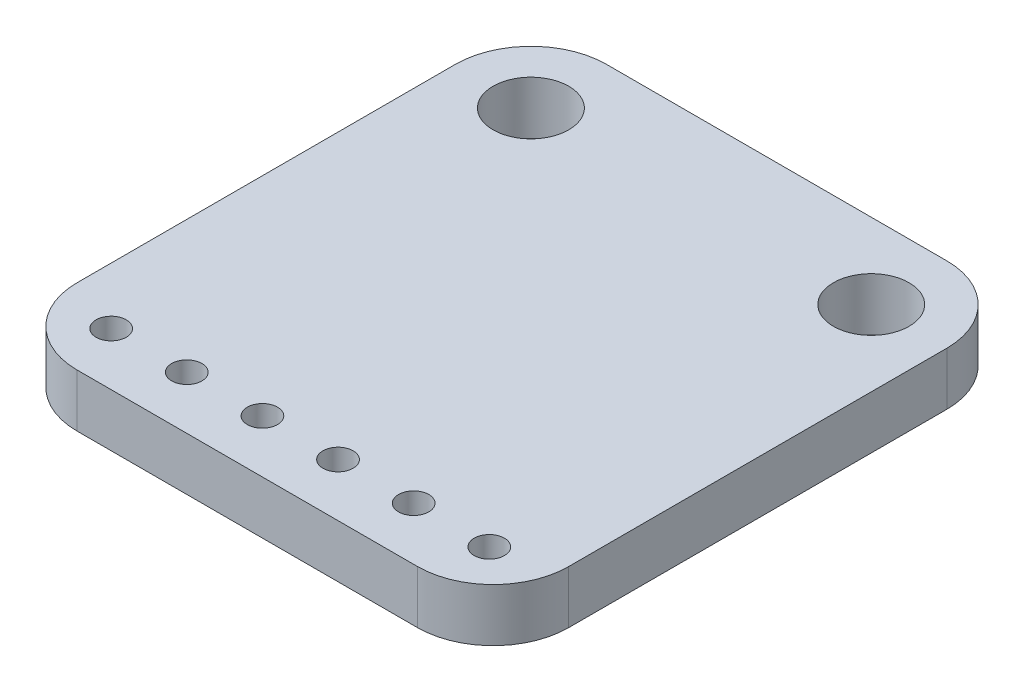
from build123d import *

# Parameters (mm, degrees)
SKETCH1_W           = 16.51
SKETCH1_H           = 17.78
BOSS_EXTRUDE1_DEPTH = 1.778
FILLET1_R           = 2.54
CUT_EXTRUDE1_REACH  = 14.261
SKETCH2_R           = 0.508
SKETCH4_W           = 3.95
SKETCH4_H           = 3.95
BOSS_EXTRUDE3_DEPTH = 1.397
CUT_EXTRUDE2_REACH  = 14.261
SKETCH5_R           = 1.27


with BuildPart() as part:
    # Sketch1 → Boss-Extrude1 (new body)
    with BuildSketch(Plane(origin=(0, 0, 0), x_dir=(1, 0, 0), z_dir=(0, 1, 0))):
        Rectangle(SKETCH1_W, SKETCH1_H)
    extrude(amount=BOSS_EXTRUDE1_DEPTH)

    # Fillet1
    fillet1_edges = [part.edges().sort_by_distance(p)[0] for p in [
        (8.255, 0.889, 8.89),
        (-8.255, 0.889, 8.89),
        (-8.255, 0.889, -8.89),
        (8.255, 0.889, -8.89),
    ]]
    fillet(fillet1_edges, radius=FILLET1_R)

    # Sketch2 → Cut-Extrude1 (cut, up to next)
    with BuildSketch(Plane(origin=(0, 1.778, 0), x_dir=(1, 0, 0), z_dir=(0, 1, 0)), mode=Mode.PRIVATE) as cut_extrude1_sk1:
        with Locations(Location((-6.35, -7.112, 0), (0, 0, 270))):
            Circle(SKETCH2_R)
    cut_extrude1_tool1 = extrude(cut_extrude1_sk1.sketch, amount=-CUT_EXTRUDE1_REACH, mode=Mode.PRIVATE) & part.part
    # Sketch2 → Cut-Extrude1 (cut, up to next)
    with BuildSketch(Plane(origin=(0, 1.778, 0), x_dir=(1, 0, 0), z_dir=(0, 1, 0)), mode=Mode.PRIVATE) as cut_extrude1_sk2:
        with Locations(Location((-3.81, -7.112, 0), (0, 0, 270))):
            Circle(SKETCH2_R)
    cut_extrude1_tool2 = extrude(cut_extrude1_sk2.sketch, amount=-CUT_EXTRUDE1_REACH, mode=Mode.PRIVATE) & part.part
    # Sketch2 → Cut-Extrude1 (cut, up to next)
    with BuildSketch(Plane(origin=(0, 1.778, 0), x_dir=(1, 0, 0), z_dir=(0, 1, 0)), mode=Mode.PRIVATE) as cut_extrude1_sk3:
        with Locations(Location((-1.27, -7.112, 0), (0, 0, 270))):
            Circle(SKETCH2_R)
    cut_extrude1_tool3 = extrude(cut_extrude1_sk3.sketch, amount=-CUT_EXTRUDE1_REACH, mode=Mode.PRIVATE) & part.part
    # Sketch2 → Cut-Extrude1 (cut, up to next)
    with BuildSketch(Plane(origin=(0, 1.778, 0), x_dir=(1, 0, 0), z_dir=(0, 1, 0)), mode=Mode.PRIVATE) as cut_extrude1_sk4:
        with Locations(Location((1.27, -7.112, 0), (0, 0, 270))):
            Circle(SKETCH2_R)
    cut_extrude1_tool4 = extrude(cut_extrude1_sk4.sketch, amount=-CUT_EXTRUDE1_REACH, mode=Mode.PRIVATE) & part.part
    # Sketch2 → Cut-Extrude1 (cut, up to next)
    with BuildSketch(Plane(origin=(0, 1.778, 0), x_dir=(1, 0, 0), z_dir=(0, 1, 0)), mode=Mode.PRIVATE) as cut_extrude1_sk5:
        with Locations(Location((3.81, -7.112, 0), (0, 0, 270))):
            Circle(SKETCH2_R)
    cut_extrude1_tool5 = extrude(cut_extrude1_sk5.sketch, amount=-CUT_EXTRUDE1_REACH, mode=Mode.PRIVATE) & part.part
    # Sketch2 → Cut-Extrude1 (cut, up to next)
    with BuildSketch(Plane(origin=(0, 1.778, 0), x_dir=(1, 0, 0), z_dir=(0, 1, 0)), mode=Mode.PRIVATE) as cut_extrude1_sk6:
        with Locations(Location((6.35, -7.112, 0), (0, 0, 270))):
            Circle(SKETCH2_R)
    cut_extrude1_tool6 = extrude(cut_extrude1_sk6.sketch, amount=-CUT_EXTRUDE1_REACH, mode=Mode.PRIVATE) & part.part
    add(cut_extrude1_tool1.solids().sort_by_distance((-6.35, 1.778, 7.112))[0], mode=Mode.SUBTRACT)
    add(cut_extrude1_tool2.solids().sort_by_distance((-3.81, 1.778, 7.112))[0], mode=Mode.SUBTRACT)
    add(cut_extrude1_tool3.solids().sort_by_distance((-1.27, 1.778, 7.112))[0], mode=Mode.SUBTRACT)
    add(cut_extrude1_tool4.solids().sort_by_distance((1.27, 1.778, 7.112))[0], mode=Mode.SUBTRACT)
    add(cut_extrude1_tool5.solids().sort_by_distance((3.81, 1.778, 7.112))[0], mode=Mode.SUBTRACT)
    add(cut_extrude1_tool6.solids().sort_by_distance((6.35, 1.778, 7.112))[0], mode=Mode.SUBTRACT)

    # Sketch4 → Boss-Extrude3 (add)
    with BuildSketch(Plane(origin=(0, 0, 0), x_dir=(-1, 0, 0), z_dir=(0, -1, 0))):
        with Locations((0, 1.27)):
            Rectangle(SKETCH4_W, SKETCH4_H)
    extrude(amount=BOSS_EXTRUDE3_DEPTH)

    # Sketch5 → Cut-Extrude2 (cut, up to next)
    with BuildSketch(Plane(origin=(0, 0, 0), x_dir=(-1, 0, 0), z_dir=(0, -1, 0)), mode=Mode.PRIVATE) as cut_extrude2_sk1:
        with Locations(Location((-5.715, 6.35, 0), (0, 0, 90))):
            Circle(SKETCH5_R)
    cut_extrude2_tool1 = extrude(cut_extrude2_sk1.sketch, amount=-CUT_EXTRUDE2_REACH, mode=Mode.PRIVATE) & part.part
    # Sketch5 → Cut-Extrude2 (cut, up to next)
    with BuildSketch(Plane(origin=(0, 0, 0), x_dir=(-1, 0, 0), z_dir=(0, -1, 0)), mode=Mode.PRIVATE) as cut_extrude2_sk2:
        with Locations(Location((5.715, 6.35, 0), (0, 0, 90))):
            Circle(SKETCH5_R)
    cut_extrude2_tool2 = extrude(cut_extrude2_sk2.sketch, amount=-CUT_EXTRUDE2_REACH, mode=Mode.PRIVATE) & part.part
    add(cut_extrude2_tool1.solids().sort_by_distance((5.715, 0, -6.35))[0], mode=Mode.SUBTRACT)
    add(cut_extrude2_tool2.solids().sort_by_distance((-5.715, 0, -6.35))[0], mode=Mode.SUBTRACT)


solid = part.part
